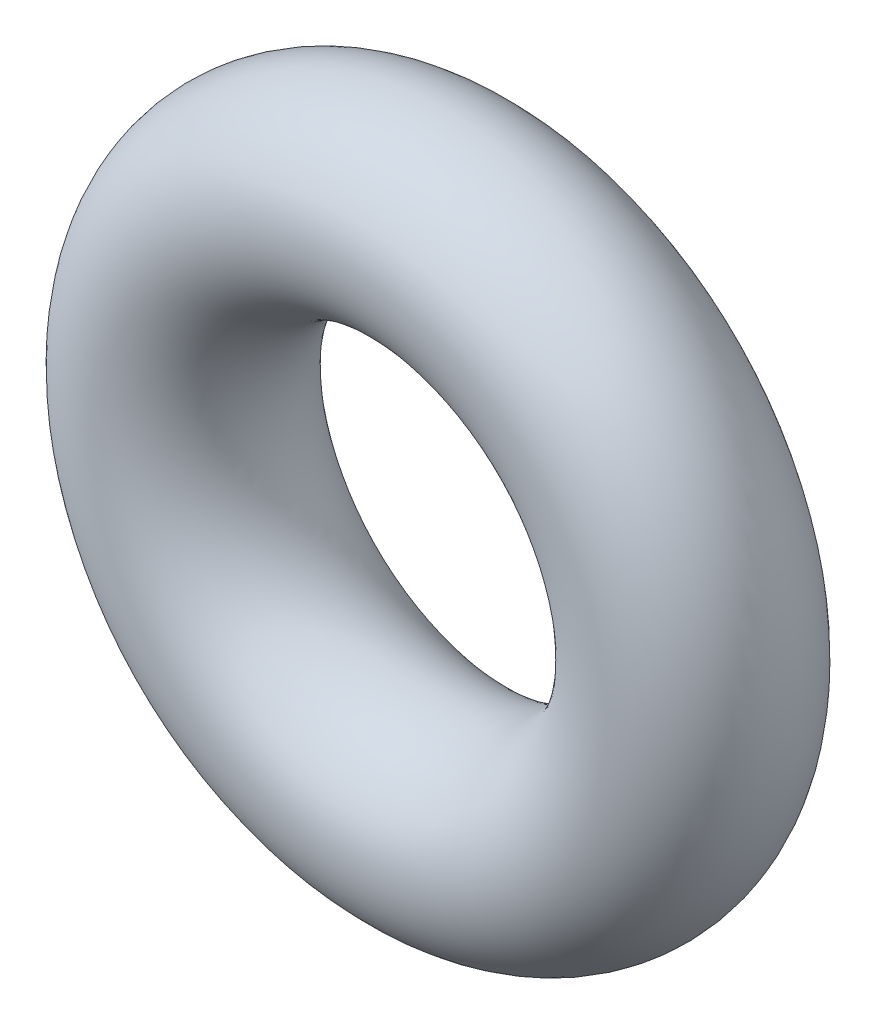
from build123d import *

# Parameters (mm, degrees)
SKETCH1_R = 0.889


with BuildPart() as part:
    # Sketch1 → Revolve1 (revolve)
    with BuildSketch(Plane(origin=(0, 0, 0), x_dir=(0, 0, -1), z_dir=(1, 0, 0)), mode=Mode.PRIVATE) as revolve1_sk:
        with Locations((0, 2.3368)):
            Circle(SKETCH1_R)
    revolve(revolve1_sk.sketch.rotate(Axis((0, 0, 0), (0, 0, -1)), 90), axis=Axis((0, 0, 0), (0, 0, -1)))


solid = part.part
